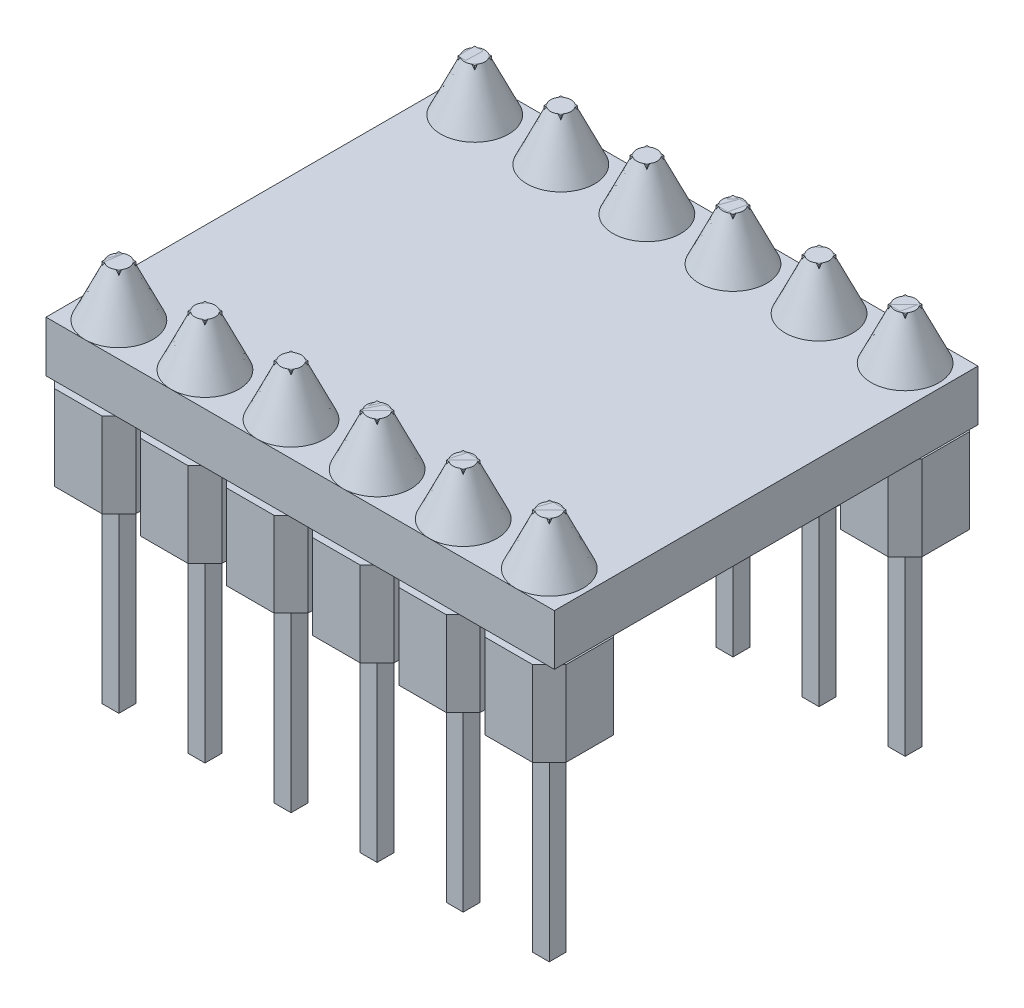
from build123d import *

# Parameters (mm, degrees)
SKETCH1_W                = 15
SKETCH1_H                = 12.5
PCB_DEPTH                = 1.5
PINS_DEPTH               = 1.5
PINS_DEPTH_BACK          = 9.8
SKETCH2_W                = 0.5
SKETCH2_H                = 0.5
PINS_2_DEPTH             = 1.5
PINS_2_DEPTH_BACK        = 9.8
PINS_3_DEPTH             = 1.5
PINS_3_DEPTH_BACK        = 9.8
PINS_4_DEPTH             = 1.5
PINS_4_DEPTH_BACK        = 9.8
PINS_5_DEPTH             = 1.5
PINS_5_DEPTH_BACK        = 9.8
PINS_6_DEPTH             = 1.5
PINS_6_DEPTH_BACK        = 9.8
PINS_7_DEPTH             = 1.5
PINS_7_DEPTH_BACK        = 9.8
PINS_8_DEPTH             = 1.5
PINS_8_DEPTH_BACK        = 9.8
PINS_9_DEPTH             = 1.5
PINS_9_DEPTH_BACK        = 9.8
PINS_10_DEPTH            = 1.5
PINS_10_DEPTH_BACK       = 9.8
PINS_11_DEPTH            = 1.5
PINS_11_DEPTH_BACK       = 9.8
PINS_12_DEPTH            = 1.5
PINS_12_DEPTH_BACK       = 9.8
PIN_SUPPORTS_DEPTH       = 2.5
PIN_SUPPORTS_2_DEPTH     = 2.5
PIN_SUPPORTS_3_DEPTH     = 2.5
PIN_SUPPORTS_4_DEPTH     = 2.5
PIN_SUPPORTS_5_DEPTH     = 2.5
PIN_SUPPORTS_6_DEPTH     = 2.5
PIN_SUPPORTS_7_DEPTH     = 2.5
PIN_SUPPORTS_8_DEPTH     = 2.5
PIN_SUPPORTS_9_DEPTH     = 2.5
PIN_SUPPORTS_10_DEPTH    = 2.5
PIN_SUPPORTS_11_DEPTH    = 2.5
PIN_SUPPORTS_12_DEPTH    = 2.5
SKETCH4_R                = 1
SOLDERS_DEPTH            = 1.5
SOLDERS_DRAFT            = 25
SOLDERS_PROFILE_2_DEPTH  = 1.5
SOLDERS_PROFILE_2_DRAFT  = 25
SOLDERS_PROFILE_3_DEPTH  = 1.5
SOLDERS_PROFILE_3_DRAFT  = 25
SOLDERS_PROFILE_4_DEPTH  = 1.5
SOLDERS_PROFILE_4_DRAFT  = 25
SOLDERS_PROFILE_5_DEPTH  = 1.5
SOLDERS_PROFILE_5_DRAFT  = 25
SOLDERS_PROFILE_6_DEPTH  = 1.5
SOLDERS_PROFILE_6_DRAFT  = 25
SOLDERS_PROFILE_7_DEPTH  = 1.5
SOLDERS_PROFILE_7_DRAFT  = 25
SOLDERS_PROFILE_8_DEPTH  = 1.5
SOLDERS_PROFILE_8_DRAFT  = 25
SOLDERS_PROFILE_9_DEPTH  = 1.5
SOLDERS_PROFILE_9_DRAFT  = 25
SOLDERS_PROFILE_10_DEPTH = 1.5
SOLDERS_PROFILE_10_DRAFT = 25
SOLDERS_PROFILE_11_DEPTH = 1.5
SOLDERS_PROFILE_11_DRAFT = 25
SOLDERS_PROFILE_12_DEPTH = 1.5
SOLDERS_PROFILE_12_DRAFT = 25


with BuildPart() as part:
    # Sketch1 → pcb (new body)
    with BuildSketch(Plane(origin=(0, 0, 0), x_dir=(1, 0, 0), z_dir=(0, 1, 0))):
        Rectangle(SKETCH1_W, SKETCH1_H)
    extrude(amount=PCB_DEPTH)


with BuildPart() as body_2:
    # Sketch2 → pins (new, two sides: drawn at the far end of the back side and taken through both)
    with BuildSketch(Plane(origin=(0, 1.5, 0), x_dir=(1, 0, 0), z_dir=(0, 1, 0)).offset(-PINS_DEPTH_BACK)):
        with Locations((-6.35, 5.25)):
            Rectangle(SKETCH2_W, SKETCH2_H)
    extrude(amount=PINS_DEPTH + PINS_DEPTH_BACK)


with BuildPart() as body_3:
    # Sketch2 → pins 2 (new, two sides: drawn at the far end of the back side and taken through both)
    with BuildSketch(Plane(origin=(0, 1.5, 0), x_dir=(1, 0, 0), z_dir=(0, 1, 0)).offset(-PINS_2_DEPTH_BACK)):
        with Locations((-6.35, -5.25)):
            Rectangle(SKETCH2_W, SKETCH2_H)
    extrude(amount=PINS_2_DEPTH + PINS_2_DEPTH_BACK)


with BuildPart() as body_4:
    # Sketch2 → pins 3 (new, two sides: drawn at the far end of the back side and taken through both)
    with BuildSketch(Plane(origin=(0, 1.5, 0), x_dir=(1, 0, 0), z_dir=(0, 1, 0)).offset(-PINS_3_DEPTH_BACK)):
        with Locations((-3.81, 5.25)):
            Rectangle(SKETCH2_W, SKETCH2_H)
    extrude(amount=PINS_3_DEPTH + PINS_3_DEPTH_BACK)


with BuildPart() as body_5:
    # Sketch2 → pins 4 (new, two sides: drawn at the far end of the back side and taken through both)
    with BuildSketch(Plane(origin=(0, 1.5, 0), x_dir=(1, 0, 0), z_dir=(0, 1, 0)).offset(-PINS_4_DEPTH_BACK)):
        with Locations((-3.81, -5.25)):
            Rectangle(SKETCH2_W, SKETCH2_H)
    extrude(amount=PINS_4_DEPTH + PINS_4_DEPTH_BACK)


with BuildPart() as body_6:
    # Sketch2 → pins 5 (new, two sides: drawn at the far end of the back side and taken through both)
    with BuildSketch(Plane(origin=(0, 1.5, 0), x_dir=(1, 0, 0), z_dir=(0, 1, 0)).offset(-PINS_5_DEPTH_BACK)):
        with Locations((-1.27, 5.25)):
            Rectangle(SKETCH2_W, SKETCH2_H)
    extrude(amount=PINS_5_DEPTH + PINS_5_DEPTH_BACK)


with BuildPart() as body_7:
    # Sketch2 → pins 6 (new, two sides: drawn at the far end of the back side and taken through both)
    with BuildSketch(Plane(origin=(0, 1.5, 0), x_dir=(1, 0, 0), z_dir=(0, 1, 0)).offset(-PINS_6_DEPTH_BACK)):
        with Locations((-1.27, -5.25)):
            Rectangle(SKETCH2_W, SKETCH2_H)
    extrude(amount=PINS_6_DEPTH + PINS_6_DEPTH_BACK)


with BuildPart() as body_8:
    # Sketch2 → pins 7 (new, two sides: drawn at the far end of the back side and taken through both)
    with BuildSketch(Plane(origin=(0, 1.5, 0), x_dir=(1, 0, 0), z_dir=(0, 1, 0)).offset(-PINS_7_DEPTH_BACK)):
        with Locations((1.27, 5.25)):
            Rectangle(SKETCH2_W, SKETCH2_H)
    extrude(amount=PINS_7_DEPTH + PINS_7_DEPTH_BACK)


with BuildPart() as body_9:
    # Sketch2 → pins 8 (new, two sides: drawn at the far end of the back side and taken through both)
    with BuildSketch(Plane(origin=(0, 1.5, 0), x_dir=(1, 0, 0), z_dir=(0, 1, 0)).offset(-PINS_8_DEPTH_BACK)):
        with Locations((1.27, -5.25)):
            Rectangle(SKETCH2_W, SKETCH2_H)
    extrude(amount=PINS_8_DEPTH + PINS_8_DEPTH_BACK)


with BuildPart() as body_10:
    # Sketch2 → pins 9 (new, two sides: drawn at the far end of the back side and taken through both)
    with BuildSketch(Plane(origin=(0, 1.5, 0), x_dir=(1, 0, 0), z_dir=(0, 1, 0)).offset(-PINS_9_DEPTH_BACK)):
        with Locations((3.81, 5.25)):
            Rectangle(SKETCH2_W, SKETCH2_H)
    extrude(amount=PINS_9_DEPTH + PINS_9_DEPTH_BACK)


with BuildPart() as body_11:
    # Sketch2 → pins 10 (new, two sides: drawn at the far end of the back side and taken through both)
    with BuildSketch(Plane(origin=(0, 1.5, 0), x_dir=(1, 0, 0), z_dir=(0, 1, 0)).offset(-PINS_10_DEPTH_BACK)):
        with Locations((3.81, -5.25)):
            Rectangle(SKETCH2_W, SKETCH2_H)
    extrude(amount=PINS_10_DEPTH + PINS_10_DEPTH_BACK)


with BuildPart() as body_12:
    # Sketch2 → pins 11 (new, two sides: drawn at the far end of the back side and taken through both)
    with BuildSketch(Plane(origin=(0, 1.5, 0), x_dir=(1, 0, 0), z_dir=(0, 1, 0)).offset(-PINS_11_DEPTH_BACK)):
        with Locations((6.35, 5.25)):
            Rectangle(SKETCH2_W, SKETCH2_H)
    extrude(amount=PINS_11_DEPTH + PINS_11_DEPTH_BACK)


with BuildPart() as body_13:
    # Sketch2 → pins 12 (new, two sides: drawn at the far end of the back side and taken through both)
    with BuildSketch(Plane(origin=(0, 1.5, 0), x_dir=(1, 0, 0), z_dir=(0, 1, 0)).offset(-PINS_12_DEPTH_BACK)):
        with Locations((6.35, -5.25)):
            Rectangle(SKETCH2_W, SKETCH2_H)
    extrude(amount=PINS_12_DEPTH + PINS_12_DEPTH_BACK)


with BuildPart() as body_14:
    # Sketch3 → pin_supports (new body)
    with BuildSketch(Plane.XZ):
        Polygon((-5.65, 4.05), (-7.05, 4.05), (-7.55, 4.55), (-7.55, 5.95), (-7.05, 6.45), (-5.65, 6.45), (-5.15, 5.95), (-5.15, 4.55), align=None)
    extrude(amount=PIN_SUPPORTS_DEPTH)


with BuildPart() as body_15:
    # Sketch3 → pin_supports 2 (new body)
    with BuildSketch(Plane.XZ):
        Polygon((-5.65, -6.45), (-7.05, -6.45), (-7.55, -5.95), (-7.55, -4.55), (-7.05, -4.05), (-5.65, -4.05), (-5.15, -4.55), (-5.15, -5.95), align=None)
    extrude(amount=PIN_SUPPORTS_2_DEPTH)


with BuildPart() as body_16:
    # Sketch3 → pin_supports 3 (new body)
    with BuildSketch(Plane.XZ):
        Polygon((-2.61, 4.55), (-2.61, 5.95), (-3.11, 6.45), (-4.51, 6.45), (-5.01, 5.95), (-5.01, 4.55), (-4.51, 4.05), (-3.11, 4.05), align=None)
    extrude(amount=PIN_SUPPORTS_3_DEPTH)


with BuildPart() as body_17:
    # Sketch3 → pin_supports 4 (new body)
    with BuildSketch(Plane.XZ):
        Polygon((-3.11, -6.45), (-4.51, -6.45), (-5.01, -5.95), (-5.01, -4.55), (-4.51, -4.05), (-3.11, -4.05), (-2.61, -4.55), (-2.61, -5.95), align=None)
    extrude(amount=PIN_SUPPORTS_4_DEPTH)


with BuildPart() as body_18:
    # Sketch3 → pin_supports 5 (new body)
    with BuildSketch(Plane.XZ):
        Polygon((-0.07, 4.55), (-0.07, 5.95), (-0.57, 6.45), (-1.97, 6.45), (-2.47, 5.95), (-2.47, 4.55), (-1.97, 4.05), (-0.57, 4.05), align=None)
    extrude(amount=PIN_SUPPORTS_5_DEPTH)


with BuildPart() as body_19:
    # Sketch3 → pin_supports 6 (new body)
    with BuildSketch(Plane.XZ):
        Polygon((-0.57, -6.45), (-1.97, -6.45), (-2.47, -5.95), (-2.47, -4.55), (-1.97, -4.05), (-0.57, -4.05), (-0.07, -4.55), (-0.07, -5.95), align=None)
    extrude(amount=PIN_SUPPORTS_6_DEPTH)


with BuildPart() as body_20:
    # Sketch3 → pin_supports 7 (new body)
    with BuildSketch(Plane.XZ):
        Polygon((2.47, 4.55), (2.47, 5.95), (1.97, 6.45), (0.57, 6.45), (0.07, 5.95), (0.07, 4.55), (0.57, 4.05), (1.97, 4.05), align=None)
    extrude(amount=PIN_SUPPORTS_7_DEPTH)


with BuildPart() as body_21:
    # Sketch3 → pin_supports 8 (new body)
    with BuildSketch(Plane.XZ):
        Polygon((1.97, -6.45), (0.57, -6.45), (0.07, -5.95), (0.07, -4.55), (0.57, -4.05), (1.97, -4.05), (2.47, -4.55), (2.47, -5.95), align=None)
    extrude(amount=PIN_SUPPORTS_8_DEPTH)


with BuildPart() as body_22:
    # Sketch3 → pin_supports 9 (new body)
    with BuildSketch(Plane.XZ):
        Polygon((5.01, 4.55), (5.01, 5.95), (4.51, 6.45), (3.11, 6.45), (2.61, 5.95), (2.61, 4.55), (3.11, 4.05), (4.51, 4.05), align=None)
    extrude(amount=PIN_SUPPORTS_9_DEPTH)


with BuildPart() as body_23:
    # Sketch3 → pin_supports 10 (new body)
    with BuildSketch(Plane.XZ):
        Polygon((4.51, -6.45), (3.11, -6.45), (2.61, -5.95), (2.61, -4.55), (3.11, -4.05), (4.51, -4.05), (5.01, -4.55), (5.01, -5.95), align=None)
    extrude(amount=PIN_SUPPORTS_10_DEPTH)


with BuildPart() as body_24:
    # Sketch3 → pin_supports 11 (new body)
    with BuildSketch(Plane.XZ):
        Polygon((7.55, 4.55), (7.55, 5.95), (7.05, 6.45), (5.65, 6.45), (5.15, 5.95), (5.15, 4.55), (5.65, 4.05), (7.05, 4.05), align=None)
    extrude(amount=PIN_SUPPORTS_11_DEPTH)


with BuildPart() as body_25:
    # Sketch3 → pin_supports 12 (new body)
    with BuildSketch(Plane.XZ):
        Polygon((7.05, -6.45), (5.65, -6.45), (5.15, -5.95), (5.15, -4.55), (5.65, -4.05), (7.05, -4.05), (7.55, -4.55), (7.55, -5.95), align=None)
    extrude(amount=PIN_SUPPORTS_12_DEPTH)


with BuildPart() as body_26:
    # Sketch4 → solders (with draft: the straight prism first)
    with BuildSketch(Plane(origin=(0, 1.5, 0), x_dir=(1, 0, 0), z_dir=(0, 1, 0))):
        with Locations((-6.35, -5.25)):
            Circle(SKETCH4_R)
    extrude(amount=SOLDERS_DEPTH)
    # solders: the draft: its side faces are tilted about the plane it starts from
    solders_sides = [body_26.faces().sort_by_distance(p)[0] for p in [
        (-7.35, 2.25, 5.25),
    ]]
    draft(solders_sides, Plane(origin=(0, 1.5, 0), x_dir=(1, 0, 0), z_dir=(0, 1, 0)), SOLDERS_DRAFT)


with BuildPart() as body_27:
    # Sketch4 → solders profile 2 (with draft: the straight prism first)
    with BuildSketch(Plane(origin=(0, 1.5, 0), x_dir=(1, 0, 0), z_dir=(0, 1, 0))):
        with Locations((-6.35, 5.25)):
            Circle(SKETCH4_R)
    extrude(amount=SOLDERS_PROFILE_2_DEPTH)
    # solders profile 2: the draft: its side faces are tilted about the plane it starts from
    solders_profile_2_sides = [body_27.faces().sort_by_distance(p)[0] for p in [
        (-7.35, 2.25, -5.25),
    ]]
    draft(solders_profile_2_sides, Plane(origin=(0, 1.5, 0), x_dir=(1, 0, 0), z_dir=(0, 1, 0)), SOLDERS_PROFILE_2_DRAFT)


with BuildPart() as body_28:
    # Sketch4 → solders profile 3 (with draft: the straight prism first)
    with BuildSketch(Plane(origin=(0, 1.5, 0), x_dir=(1, 0, 0), z_dir=(0, 1, 0))):
        with Locations((-3.81, -5.25)):
            Circle(SKETCH4_R)
    extrude(amount=SOLDERS_PROFILE_3_DEPTH)
    # solders profile 3: the draft: its side faces are tilted about the plane it starts from
    solders_profile_3_sides = [body_28.faces().sort_by_distance(p)[0] for p in [
        (-4.81, 2.25, 5.25),
    ]]
    draft(solders_profile_3_sides, Plane(origin=(0, 1.5, 0), x_dir=(1, 0, 0), z_dir=(0, 1, 0)), SOLDERS_PROFILE_3_DRAFT)


with BuildPart() as body_29:
    # Sketch4 → solders profile 4 (with draft: the straight prism first)
    with BuildSketch(Plane(origin=(0, 1.5, 0), x_dir=(1, 0, 0), z_dir=(0, 1, 0))):
        with Locations((-3.81, 5.25)):
            Circle(SKETCH4_R)
    extrude(amount=SOLDERS_PROFILE_4_DEPTH)
    # solders profile 4: the draft: its side faces are tilted about the plane it starts from
    solders_profile_4_sides = [body_29.faces().sort_by_distance(p)[0] for p in [
        (-4.81, 2.25, -5.25),
    ]]
    draft(solders_profile_4_sides, Plane(origin=(0, 1.5, 0), x_dir=(1, 0, 0), z_dir=(0, 1, 0)), SOLDERS_PROFILE_4_DRAFT)


with BuildPart() as body_30:
    # Sketch4 → solders profile 5 (with draft: the straight prism first)
    with BuildSketch(Plane(origin=(0, 1.5, 0), x_dir=(1, 0, 0), z_dir=(0, 1, 0))):
        with Locations((-1.27, -5.25)):
            Circle(SKETCH4_R)
    extrude(amount=SOLDERS_PROFILE_5_DEPTH)
    # solders profile 5: the draft: its side faces are tilted about the plane it starts from
    solders_profile_5_sides = [body_30.faces().sort_by_distance(p)[0] for p in [
        (-2.27, 2.25, 5.25),
    ]]
    draft(solders_profile_5_sides, Plane(origin=(0, 1.5, 0), x_dir=(1, 0, 0), z_dir=(0, 1, 0)), SOLDERS_PROFILE_5_DRAFT)


with BuildPart() as body_31:
    # Sketch4 → solders profile 6 (with draft: the straight prism first)
    with BuildSketch(Plane(origin=(0, 1.5, 0), x_dir=(1, 0, 0), z_dir=(0, 1, 0))):
        with Locations((-1.27, 5.25)):
            Circle(SKETCH4_R)
    extrude(amount=SOLDERS_PROFILE_6_DEPTH)
    # solders profile 6: the draft: its side faces are tilted about the plane it starts from
    solders_profile_6_sides = [body_31.faces().sort_by_distance(p)[0] for p in [
        (-2.27, 2.25, -5.25),
    ]]
    draft(solders_profile_6_sides, Plane(origin=(0, 1.5, 0), x_dir=(1, 0, 0), z_dir=(0, 1, 0)), SOLDERS_PROFILE_6_DRAFT)


with BuildPart() as body_32:
    # Sketch4 → solders profile 7 (with draft: the straight prism first)
    with BuildSketch(Plane(origin=(0, 1.5, 0), x_dir=(1, 0, 0), z_dir=(0, 1, 0))):
        with Locations((1.27, -5.25)):
            Circle(SKETCH4_R)
    extrude(amount=SOLDERS_PROFILE_7_DEPTH)
    # solders profile 7: the draft: its side faces are tilted about the plane it starts from
    solders_profile_7_sides = [body_32.faces().sort_by_distance(p)[0] for p in [
        (0.27, 2.25, 5.25),
    ]]
    draft(solders_profile_7_sides, Plane(origin=(0, 1.5, 0), x_dir=(1, 0, 0), z_dir=(0, 1, 0)), SOLDERS_PROFILE_7_DRAFT)


with BuildPart() as body_33:
    # Sketch4 → solders profile 8 (with draft: the straight prism first)
    with BuildSketch(Plane(origin=(0, 1.5, 0), x_dir=(1, 0, 0), z_dir=(0, 1, 0))):
        with Locations((1.27, 5.25)):
            Circle(SKETCH4_R)
    extrude(amount=SOLDERS_PROFILE_8_DEPTH)
    # solders profile 8: the draft: its side faces are tilted about the plane it starts from
    solders_profile_8_sides = [body_33.faces().sort_by_distance(p)[0] for p in [
        (0.27, 2.25, -5.25),
    ]]
    draft(solders_profile_8_sides, Plane(origin=(0, 1.5, 0), x_dir=(1, 0, 0), z_dir=(0, 1, 0)), SOLDERS_PROFILE_8_DRAFT)


with BuildPart() as body_34:
    # Sketch4 → solders profile 9 (with draft: the straight prism first)
    with BuildSketch(Plane(origin=(0, 1.5, 0), x_dir=(1, 0, 0), z_dir=(0, 1, 0))):
        with Locations((3.81, -5.25)):
            Circle(SKETCH4_R)
    extrude(amount=SOLDERS_PROFILE_9_DEPTH)
    # solders profile 9: the draft: its side faces are tilted about the plane it starts from
    solders_profile_9_sides = [body_34.faces().sort_by_distance(p)[0] for p in [
        (2.81, 2.25, 5.25),
    ]]
    draft(solders_profile_9_sides, Plane(origin=(0, 1.5, 0), x_dir=(1, 0, 0), z_dir=(0, 1, 0)), SOLDERS_PROFILE_9_DRAFT)


with BuildPart() as body_35:
    # Sketch4 → solders profile 10 (with draft: the straight prism first)
    with BuildSketch(Plane(origin=(0, 1.5, 0), x_dir=(1, 0, 0), z_dir=(0, 1, 0))):
        with Locations((3.81, 5.25)):
            Circle(SKETCH4_R)
    extrude(amount=SOLDERS_PROFILE_10_DEPTH)
    # solders profile 10: the draft: its side faces are tilted about the plane it starts from
    solders_profile_10_sides = [body_35.faces().sort_by_distance(p)[0] for p in [
        (2.81, 2.25, -5.25),
    ]]
    draft(solders_profile_10_sides, Plane(origin=(0, 1.5, 0), x_dir=(1, 0, 0), z_dir=(0, 1, 0)), SOLDERS_PROFILE_10_DRAFT)


with BuildPart() as body_36:
    # Sketch4 → solders profile 11 (with draft: the straight prism first)
    with BuildSketch(Plane(origin=(0, 1.5, 0), x_dir=(1, 0, 0), z_dir=(0, 1, 0))):
        with Locations((6.35, -5.25)):
            Circle(SKETCH4_R)
    extrude(amount=SOLDERS_PROFILE_11_DEPTH)
    # solders profile 11: the draft: its side faces are tilted about the plane it starts from
    solders_profile_11_sides = [body_36.faces().sort_by_distance(p)[0] for p in [
        (5.35, 2.25, 5.25),
    ]]
    draft(solders_profile_11_sides, Plane(origin=(0, 1.5, 0), x_dir=(1, 0, 0), z_dir=(0, 1, 0)), SOLDERS_PROFILE_11_DRAFT)


with BuildPart() as body_37:
    # Sketch4 → solders profile 12 (with draft: the straight prism first)
    with BuildSketch(Plane(origin=(0, 1.5, 0), x_dir=(1, 0, 0), z_dir=(0, 1, 0))):
        with Locations((6.35, 5.25)):
            Circle(SKETCH4_R)
    extrude(amount=SOLDERS_PROFILE_12_DEPTH)
    # solders profile 12: the draft: its side faces are tilted about the plane it starts from
    solders_profile_12_sides = [body_37.faces().sort_by_distance(p)[0] for p in [
        (5.35, 2.25, -5.25),
    ]]
    draft(solders_profile_12_sides, Plane(origin=(0, 1.5, 0), x_dir=(1, 0, 0), z_dir=(0, 1, 0)), SOLDERS_PROFILE_12_DRAFT)


solid = Compound([part.part, body_2.part, body_3.part, body_4.part, body_5.part, body_6.part, body_7.part, body_8.part, body_9.part, body_10.part, body_11.part, body_12.part, body_13.part, body_14.part, body_15.part, body_16.part, body_17.part, body_18.part, body_19.part, body_20.part, body_21.part, body_22.part, body_23.part, body_24.part, body_25.part, body_26.part, body_27.part, body_28.part, body_29.part, body_30.part, body_31.part, body_32.part, body_33.part, body_34.part, body_35.part, body_36.part, body_37.part])
